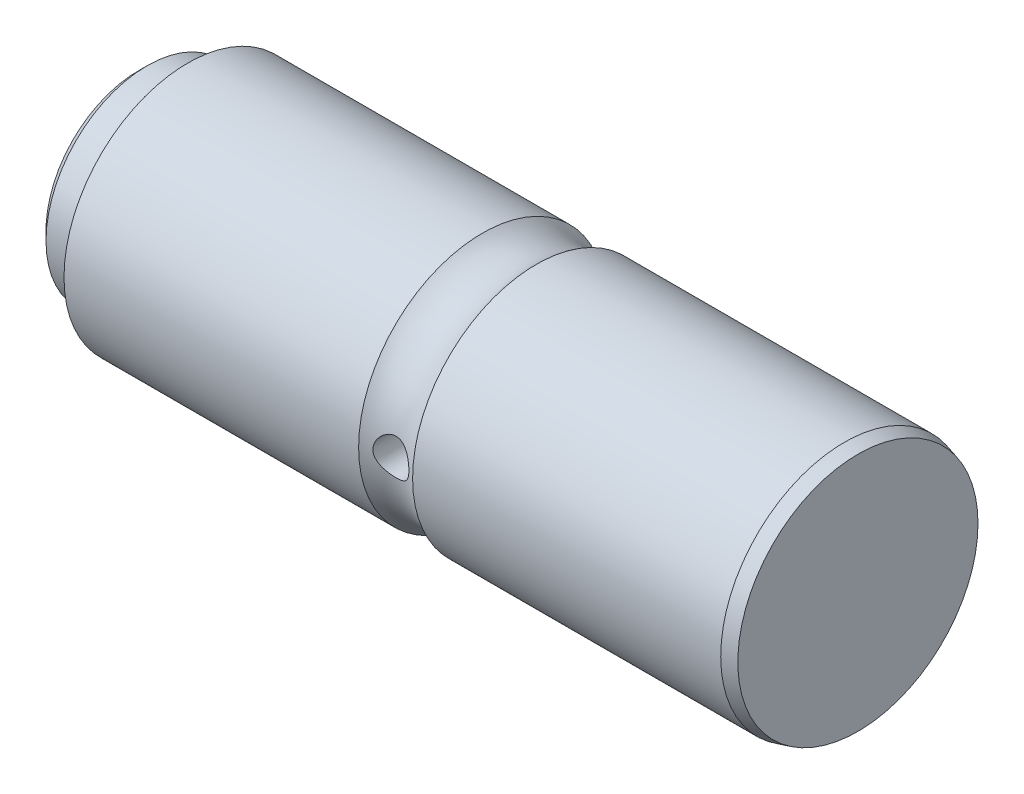
from build123d import *

# Parameters (mm, degrees)
SKETCH_2_R                = 4
CUT_EXTRUDE_1_DEPTH       = 30
CHAMFER_1_SIZE            = 2
CHAMFER_2_SIZE            = 3
CHAMFER_2_SIZE2           = 0.803847577
SKETCH_6_R                = 15
CUT_EXTRUDE_3_DEPTH       = 10
HOLE_WIZARD_8_0_8_1_D     = 8
HOLE_WIZARD_8_0_8_1_DEPTH = 80
HOLE_WIZARD_8_0_8_1_TIP   = 2.403442476
M10X1_0_1_D               = 9
M10X1_0_1_DEPTH           = 15
M10X1_0_1_TIP             = 2.703872786


with BuildPart() as part:
    # 草图1 → 旋转1 (revolve)
    with BuildSketch(Plane.XY, mode=Mode.PRIVATE) as revolve_1_sk:
        with BuildLine():
            Line((0, 0), (0, 27.5))
            Line((0, 27.5), (-71.5, 27.5))
            ThreePointArc((-71.5, 27.5), (-77.5, 25.5), (-83.5, 27.5))
            Line((-83.5, 27.5), (-149, 27.5))
            Line((-149, 27.5), (-149, 22.5))
            Line((-149, 22.5), (-160, 22.5))
            Line((-160, 22.5), (-160, 0))
            Line((-160, 0), (0, 0))
        make_face()
    revolve(revolve_1_sk.sketch.rotate(Axis((0, 0, 0), (-1, 0, 0)), 90), axis=Axis((0, 0, 0), (-1, 0, 0)))

    # 草图2 → 切除-拉伸1 (cut, symmetric)
    with BuildSketch(Plane.XY):
        with Locations((-77.5, 0)):
            Circle(SKETCH_2_R)
    extrude(amount=CUT_EXTRUDE_1_DEPTH, both=True, mode=Mode.SUBTRACT)

    # 倒角1
    chamfer_1_edges = [part.edges().sort_by_distance(p)[0] for p in [
        (-160, 0, 22.5),
    ]]
    chamfer(chamfer_1_edges, length=CHAMFER_1_SIZE)

    # 倒角2
    chamfer_2_edges = [part.edges().sort_by_distance(p)[0] for p in [
        (0, 0, 27.5),
    ]]
    chamfer_2_side = [part.faces().sort_by_distance(p)[0] for p in [
        (-35.75, 0, 27.5),
    ]]
    chamfer(chamfer_2_edges, length=CHAMFER_2_SIZE, length2=CHAMFER_2_SIZE2, reference=chamfer_2_side[0])

    # 草图6 → 切除-拉伸3 (cut)
    with BuildSketch(Plane.ZY.offset(160)):
        Circle(SKETCH_6_R)
    extrude(amount=-CUT_EXTRUDE_3_DEPTH, mode=Mode.SUBTRACT)

    # Ø8.0 (8) 直径孔1
    with Locations(Plane(origin=(-150, 0, 0), x_dir=(0, 0, -1), z_dir=(-1, 0, 0))):
        with Locations((0, 0)):
            Hole(HOLE_WIZARD_8_0_8_1_D / 2, depth=HOLE_WIZARD_8_0_8_1_DEPTH)
            with Locations((0, 0, -(HOLE_WIZARD_8_0_8_1_DEPTH + HOLE_WIZARD_8_0_8_1_TIP / 2))):  # 118° drill point
                Cone(0, HOLE_WIZARD_8_0_8_1_D / 2, HOLE_WIZARD_8_0_8_1_TIP, mode=Mode.SUBTRACT)

    # M10x1.0 螺纹孔1
    with Locations(Plane.ZY.offset(150)):
        with Locations((0, 0)):
            Hole(M10X1_0_1_D / 2, depth=M10X1_0_1_DEPTH)
            with Locations((0, 0, -(M10X1_0_1_DEPTH + M10X1_0_1_TIP / 2))):  # 118° drill point
                Cone(0, M10X1_0_1_D / 2, M10X1_0_1_TIP, mode=Mode.SUBTRACT)


solid = part.part
